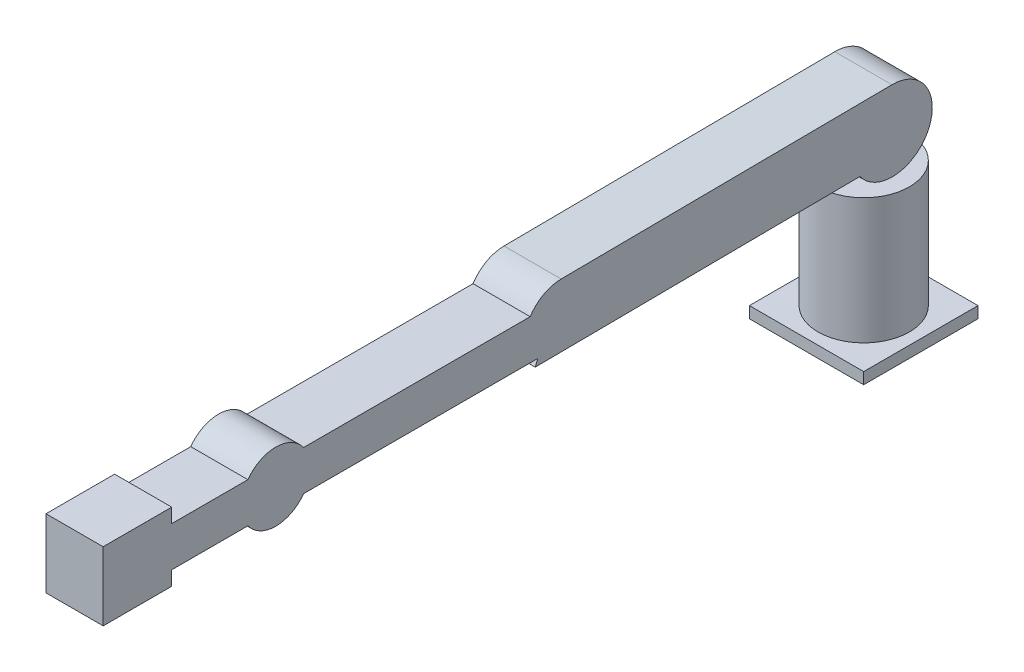
from build123d import *

# Parameters (mm, degrees)
SKETCH1_R           = 40
BOSS_EXTRUDE1_DEPTH = 110
SKETCH2_W           = 100
SKETCH2_H           = 100
BOSS_EXTRUDE2_DEPTH = 10
BOSS_EXTRUDE3_DEPTH = 25


with BuildPart() as part:
    # Sketch1 → Boss-Extrude1 (new body)
    with BuildSketch(Plane(origin=(0, 0, 0), x_dir=(1, 0, 0), z_dir=(0, 1, 0))):
        with Locations(Location((0, 0, 0), (0, 0, 270))):
            Circle(SKETCH1_R)
    extrude(amount=BOSS_EXTRUDE1_DEPTH)

    # Sketch2 → Boss-Extrude2 (add)
    with BuildSketch(Plane.XZ):
        Rectangle(SKETCH2_W, SKETCH2_H)
    extrude(amount=BOSS_EXTRUDE2_DEPTH)


with BuildPart() as body_2:
    # Sketch3 → Boss-Extrude3 (new, symmetric)
    with BuildSketch(Plane(origin=(0, 0, 0), x_dir=(0, 0, -1), z_dir=(1, 0, 0))):
        with BuildLine():
            Line((-0.302353258, 179.998694011), (-289.677340984, 177.498787296))
            ThreePointArc((-289.677340984, 177.498787296), (-305.132054802, 173.436683541), (-316.782712263, 162.5))
            Line((-316.782712263, 162.5), (-515.029598525, 162.5))
            ThreePointArc((-515.029598525, 162.5), (-539.396584387, 175), (-563.763570249, 162.5))
            Line((-563.763570249, 162.5), (-630.396584387, 162.5))
            Line((-630.396584387, 162.5), (-630.396584387, 175))
            Line((-630.396584387, 175), (-690.396584387, 175))
            Line((-690.396584387, 175), (-690.396584387, 115))
            Line((-690.396584387, 115), (-630.396584387, 115))
            Line((-630.396584387, 115), (-630.396584387, 127.5))
            Line((-630.396584387, 127.5), (-563.763570249, 127.5))
            ThreePointArc((-563.763570249, 127.5), (-539.396584387, 115), (-515.029598525, 127.5))
            Line((-515.029598525, 127.5), (-310.134949458, 127.5))
            Line((-310.134949458, 127.5), (-312.377554776, 122.019029611))
            Line((-312.377554776, 122.019029611), (-28.348406637, 124.472753689))
            ThreePointArc((-28.348406637, 124.472753689), (31.240983064, 129.220235199), (-0.302353258, 179.998694011))
        make_face()
    extrude(amount=BOSS_EXTRUDE3_DEPTH, both=True)


solid = Compound([part.part, body_2.part])
